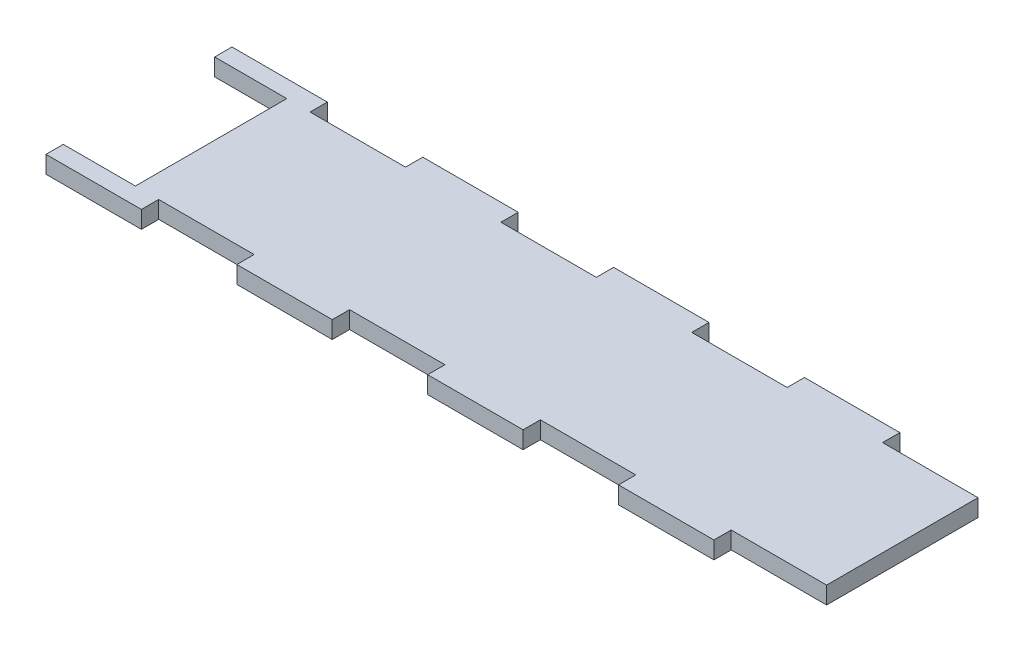
from build123d import *

# Parameters (mm, degrees)
SKETCH1_W           = 228.6
SKETCH1_H           = 49.499999806
BOSS_EXTRUDE1_DEPTH = 4.599999944
SKETCH3_W           = 25.4
SKETCH3_H           = 4.599999944
CUT_EXTRUDE1_DEPTH  = 234.943091328
SKETCH8_W           = 44.599999954
SKETCH8_H           = 40.299999918
CUT_EXTRUDE6_DEPTH  = 234.943091328


with BuildPart() as part:
    # Sketch1 → Boss-Extrude1 (new body)
    with BuildSketch(Plane(origin=(0, 0, 0), x_dir=(1, 0, 0), z_dir=(0, 1, 0))):
        with Locations((114.3, 24.749999903)):
            Rectangle(SKETCH1_W, SKETCH1_H)
    extrude(amount=BOSS_EXTRUDE1_DEPTH)

    # Sketch3 → Cut-Extrude1 (cut, through all)
    with BuildSketch(Plane(origin=(0, 4.599999944, 0), x_dir=(1, 0, 0), z_dir=(0, 1, 0))):
        with Locations((12.7, 2.299999972)):
            Rectangle(SKETCH3_W, SKETCH3_H)
        with Locations((63.5, 2.299999972)):
            Rectangle(SKETCH3_W, SKETCH3_H)
        with Locations((114.3, 2.299999972)):
            Rectangle(SKETCH3_W, SKETCH3_H)
        with Locations((165.1, 2.299999972)):
            Rectangle(SKETCH3_W, SKETCH3_H)
        with Locations((215.9, 2.299999972)):
            Rectangle(SKETCH3_W, SKETCH3_H)
    cut_extrude1 = extrude(amount=-CUT_EXTRUDE1_DEPTH, mode=Mode.SUBTRACT)

    # Mirror1: Cut-Extrude1 across plane
    add(cut_extrude1.mirror(Plane(origin=(0, 0, -24.749999903), x_dir=(1, 0, 0), z_dir=(0, 0, -1))), mode=Mode.SUBTRACT)

    # Sketch8 → Cut-Extrude6 (cut, through all)
    with BuildSketch(Plane(origin=(0, 4.599999944, 0), x_dir=(1, 0, 0), z_dir=(0, 1, 0))):
        with Locations((22.299999977, 24.749999903)):
            Rectangle(SKETCH8_W, SKETCH8_H)
    extrude(amount=-CUT_EXTRUDE6_DEPTH, mode=Mode.SUBTRACT)


solid = part.part
